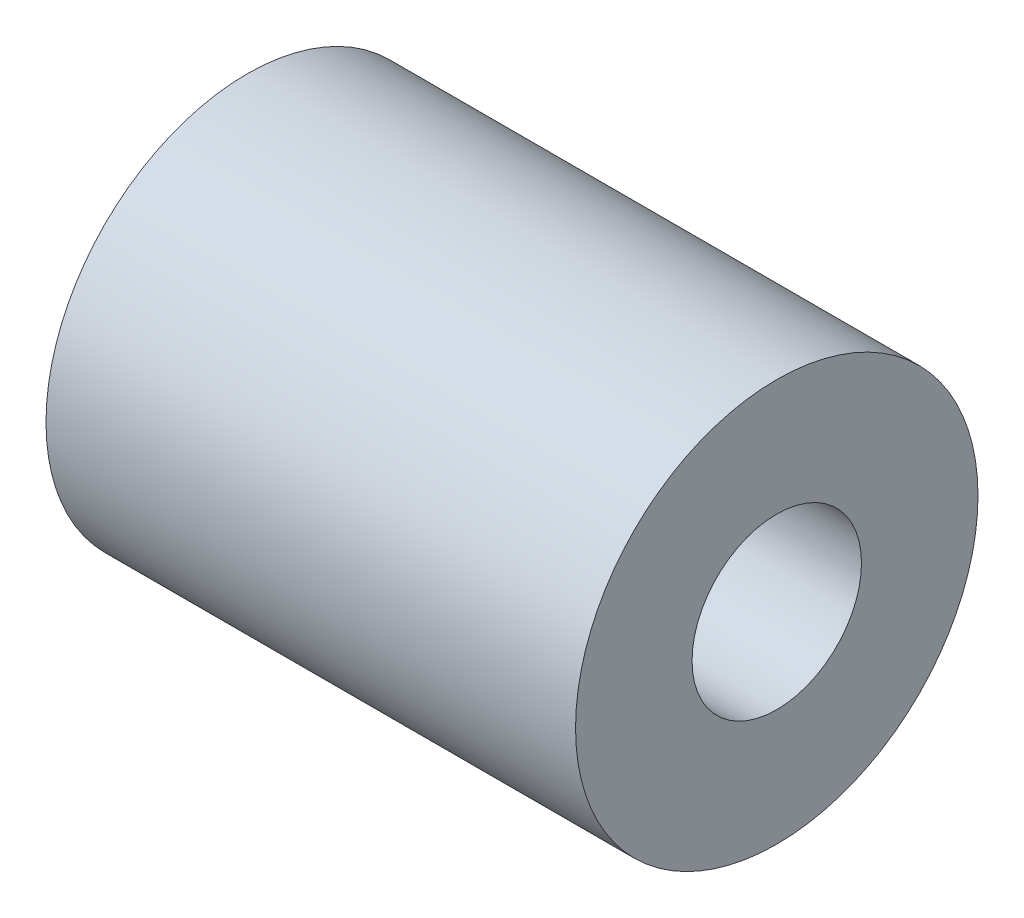
from build123d import *


with BuildPart() as part:
    # Sketch1 → Revolve1 (revolve)
    with BuildSketch(Plane(origin=(0, 0, 0), x_dir=(1, 0, 0), z_dir=(0, 1, 0)), mode=Mode.PRIVATE) as revolve1_sk:
        Polygon((-6.283783784, 2.5), (6.216216216, 2.5), (6.216216216, 4), (18.716216216, 4), (18.716216216, 9.5), (-6.283783784, 9.5), align=None)
    revolve(revolve1_sk.sketch.rotate(Axis((0, 0, 0), (1, 0, 0)), 180), axis=Axis((0, 0, 0), (1, 0, 0)))


solid = part.part
